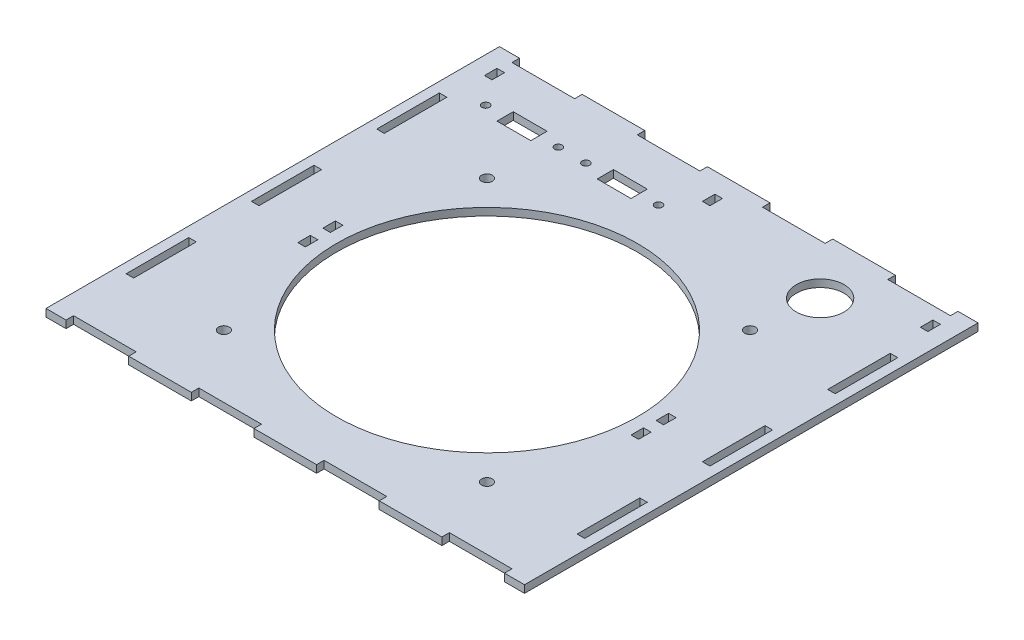
from build123d import *

# Parameters (mm, degrees)
SKICA1_W                  = 191
SKICA1_H                  = 175
P_IDAT_VYSUNUT_M1_DEPTH   = 3
SKICA13_W                 = 25
SKICA13_H                 = 3
SKICA13_W_2               = 8
P_IDAT_VYSUNUT_M5_DEPTH   = 3
SKICA14_W                 = 3
SKICA14_H                 = 5
ODEBRAT_VYSUNUT_M7_DEPTH  = 132.60357138
SKICA15_W                 = 3
SKICA15_H                 = 25
ODEBRAT_VYSUNUT_M8_DEPTH  = 132.60357138
SKICA16_W                 = 3
SKICA16_H                 = 5
ODEBRAT_VYSUNUT_M9_DEPTH  = 132.60357138
SKICA4_R                  = 2.15
SKICA4_R_2                = 60
ODEBRAT_VYSUNUT_M5_DEPTH  = 132.60357138
SKICA5_R                  = 9.5
ODEBRAT_VYSUNUT_M6_DEPTH  = 132.60357138
SKICA17_R                 = 1.5
SKICA17_W                 = 13.5
SKICA17_H                 = 6.5
ODEBRAT_VYSUNUT_M10_DEPTH = 132.60357138


with BuildPart() as part:
    # Skica1 → Přidat vysunutím1 (new body)
    with BuildSketch(Plane(origin=(0, 0, 0), x_dir=(1, 0, 0), z_dir=(0, 1, 0))):
        Rectangle(SKICA1_W, SKICA1_H)
    extrude(amount=P_IDAT_VYSUNUT_M1_DEPTH)

    # Skica13 → Přidat vysunutím5 (add)
    with BuildSketch(Plane(origin=(0, 0, 0), x_dir=(1, 0, 0), z_dir=(0, 1, 0))):
        with Locations((-50, 89)):
            Rectangle(SKICA13_W, SKICA13_H)
        with Locations((0, 89)):
            Rectangle(SKICA13_W, SKICA13_H)
        with Locations((50, 89)):
            Rectangle(SKICA13_W, SKICA13_H)
        with Locations((50, -89)):
            Rectangle(SKICA13_W, SKICA13_H)
        with Locations((0, -89)):
            Rectangle(SKICA13_W, SKICA13_H)
        with Locations((-50, -89)):
            Rectangle(SKICA13_W, SKICA13_H)
        with Locations((-91.5, 89)):
            Rectangle(SKICA13_W_2, SKICA13_H)
        with Locations((91.5, -89)):
            Rectangle(SKICA13_W_2, SKICA13_H)
        with Locations((91.5, 89)):
            Rectangle(SKICA13_W_2, SKICA13_H)
        with Locations((-91.5, -89)):
            Rectangle(SKICA13_W_2, SKICA13_H)
    extrude(amount=P_IDAT_VYSUNUT_M5_DEPTH)

    # Skica14 → Odebrat vysunutím7 (cut, through all)
    with BuildSketch(Plane(origin=(0, 0, 0), x_dir=(1, 0, 0), z_dir=(0, 1, 0))):
        with Locations((87, 80)):
            Rectangle(SKICA14_W, SKICA14_H)
        with Locations((0, 80)):
            Rectangle(SKICA14_W, SKICA14_H)
        with Locations((-87, 80)):
            Rectangle(SKICA14_W, SKICA14_H)
    extrude(amount=ODEBRAT_VYSUNUT_M7_DEPTH, mode=Mode.SUBTRACT)

    # Skica15 → Odebrat vysunutím8 (cut, through all)
    with BuildSketch(Plane(origin=(0, 0, 0), x_dir=(1, 0, 0), z_dir=(0, 1, 0))):
        with Locations((-90, 50)):
            Rectangle(SKICA15_W, SKICA15_H)
        with Locations((-90, 0)):
            Rectangle(SKICA15_W, SKICA15_H)
        with Locations((-90, -50)):
            Rectangle(SKICA15_W, SKICA15_H)
        with Locations((90, -50)):
            Rectangle(SKICA15_W, SKICA15_H)
        with Locations((90, 0)):
            Rectangle(SKICA15_W, SKICA15_H)
        with Locations((90, 50)):
            Rectangle(SKICA15_W, SKICA15_H)
    extrude(amount=ODEBRAT_VYSUNUT_M8_DEPTH, mode=Mode.SUBTRACT)

    # Skica16 → Odebrat vysunutím9 (cut, through all)
    with BuildSketch(Plane(origin=(0, 0, 0), x_dir=(1, 0, 0), z_dir=(0, 1, 0))):
        with Locations((-66.5, -5)):
            Rectangle(SKICA16_W, SKICA16_H)
        with Locations((-66.5, -15)):
            Rectangle(SKICA16_W, SKICA16_H)
        with Locations((66.5, -15)):
            Rectangle(SKICA16_W, SKICA16_H)
        with Locations((66.5, -5)):
            Rectangle(SKICA16_W, SKICA16_H)
    extrude(amount=ODEBRAT_VYSUNUT_M9_DEPTH, mode=Mode.SUBTRACT)

    # Skica4 → Odebrat vysunutím5 (cut, through all)
    with BuildSketch(Plane(origin=(0, 0, 0), x_dir=(1, 0, 0), z_dir=(0, 1, 0))):
        with Locations(Location((-52.5, -62.5, 0), (0, 0, 90))):
            Circle(SKICA4_R)
        with Locations(Location((52.5, 42.5, 0), (0, 0, 90))):
            Circle(SKICA4_R)
        with Locations(Location((0, -10, 0), (0, 0, 90))):
            Circle(SKICA4_R_2)
        with Locations(Location((-52.5, 42.5, 0), (0, 0, 90))):
            Circle(SKICA4_R)
        with Locations(Location((52.5, -62.5, 0), (0, 0, 90))):
            Circle(SKICA4_R)
    extrude(amount=ODEBRAT_VYSUNUT_M5_DEPTH, mode=Mode.SUBTRACT)

    # Skica5 → Odebrat vysunutím6 (cut, through all)
    with BuildSketch(Plane(origin=(0, 0, 0), x_dir=(1, 0, 0), z_dir=(0, 1, 0))):
        with Locations(Location((55.5, 67.5, 0), (0, 0, 90))):
            Circle(SKICA5_R)
    extrude(amount=ODEBRAT_VYSUNUT_M6_DEPTH, mode=Mode.SUBTRACT)

    # Skica17 → Odebrat vysunutím10 (cut, through all)
    with BuildSketch(Plane(origin=(0, 0, 0), x_dir=(1, 0, 0), z_dir=(0, 1, 0))):
        with Locations(Location((-78, 67.5, 0), (0, 0, 90))):
            Circle(SKICA17_R)
        with Locations(Location((-49, 67.5, 0), (0, 0, 90))):
            Circle(SKICA17_R)
        with Locations(Location((-38, 67.5, 0), (0, 0, 90))):
            Circle(SKICA17_R)
        with Locations(Location((-9, 67.5, 0), (0, 0, 90))):
            Circle(SKICA17_R)
        with Locations((-63.5, 67.5)):
            Rectangle(SKICA17_W, SKICA17_H)
        with Locations((-23.5, 67.5)):
            Rectangle(SKICA17_W, SKICA17_H)
    extrude(amount=ODEBRAT_VYSUNUT_M10_DEPTH, mode=Mode.SUBTRACT)


solid = part.part
